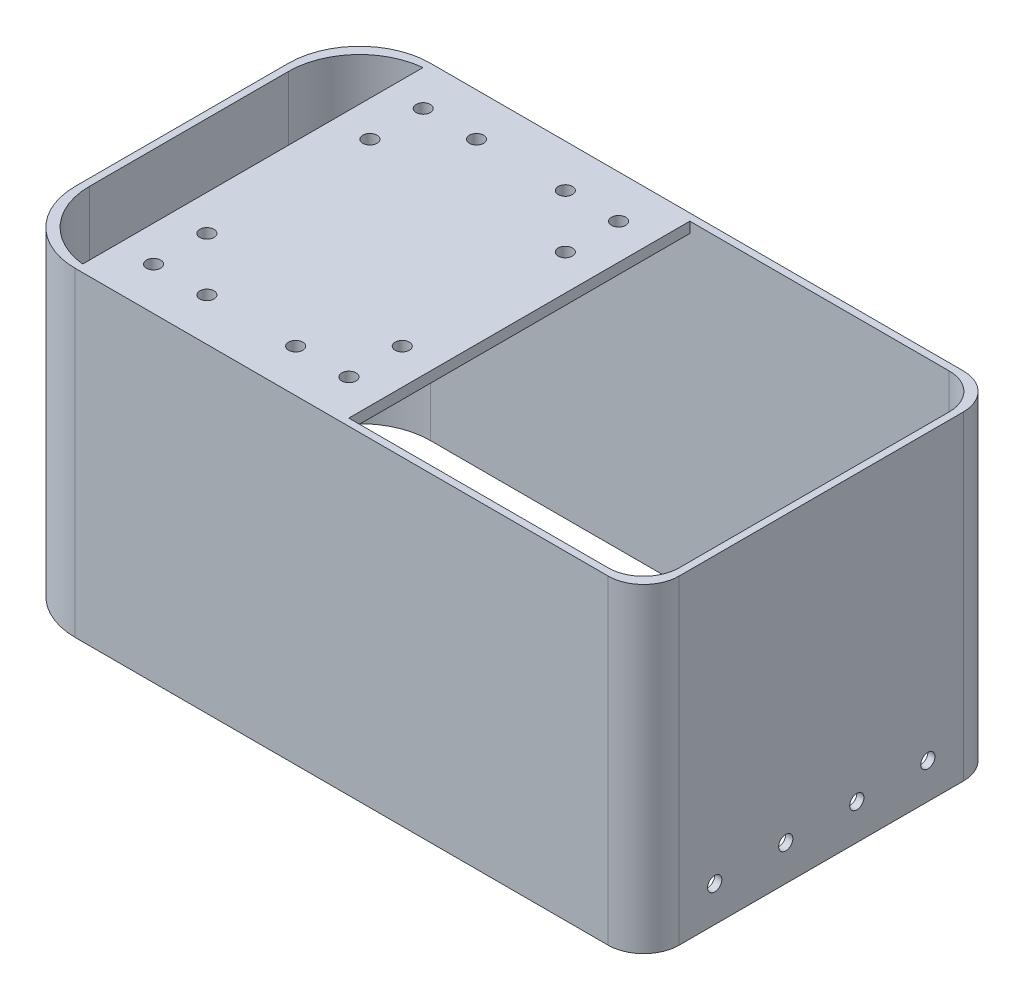
from build123d import *

# Parameters (mm, degrees)
Y_KSEKLIK_EKSTR_ZYON1_DEPTH = 90
IZIM2_W                     = 75
IZIM2_H                     = 100
Y_KSEKLIK_EKSTR_ZYON2_DEPTH = 3
IZIM3_R                     = 2
KES_EKSTR_ZYON1_DEPTH       = 10
IZIM4_R                     = 2
KES_EKSTR_ZYON2_DEPTH       = 10
KES_EKSTR_ZYON3_START       = -10
IZIM5_R                     = 2
KES_EKSTR_ZYON3_DEPTH       = 10


with BuildPart() as part:
    # Çizim1 → Yükseklik-Ekstrüzyon1 (new body)
    with BuildSketch(Plane(origin=(0, 0, 0), x_dir=(1, 0, 0), z_dir=(0, 1, 0))):
        with BuildLine():
            Line((-70, -50), (80, -50))
            ThreePointArc((80, -50), (87.071067812, -47.071067812), (90, -40))
            Line((90, -40), (90, 40))
            ThreePointArc((90, 40), (87.071067812, 47.071067812), (80, 50))
            Line((80, 50), (-70, 50))
            ThreePointArc((-70, 50), (-84.142135624, 44.142135624), (-90, 30))
            Line((-90, 30), (-90, -30))
            ThreePointArc((-90, -30), (-84.142135624, -44.142135624), (-70, -50))
        make_face()
        with BuildLine():
            Line((0, 48), (78, 48))
            ThreePointArc((78, 48), (85.071067812, 45.071067812), (88, 38))
            Line((88, 38), (88, 0))
            Line((88, 0), (88, -38))
            ThreePointArc((88, -38), (85.071067812, -45.071067812), (78, -48))
            Line((78, -48), (-68, -48))
            ThreePointArc((-68, -48), (-82.142135624, -42.142135624), (-88, -28))
            Line((-88, -28), (-88, 28))
            ThreePointArc((-88, 28), (-82.142135624, 42.142135624), (-68, 48))
            Line((-68, 48), (0, 48))
        make_face(mode=Mode.SUBTRACT)
    extrude(amount=Y_KSEKLIK_EKSTR_ZYON1_DEPTH)

    # Çizim2 → Yükseklik-Ekstrüzyon2 (add)
    with BuildSketch(Plane(origin=(0, 90, 0), x_dir=(1, 0, 0), z_dir=(0, 1, 0))):
        with Locations((-32.5, 0)):
            Rectangle(IZIM2_W, IZIM2_H)
    extrude(amount=-Y_KSEKLIK_EKSTR_ZYON2_DEPTH)

    # Çizim3 → Kes-Ekstrüzyon1 (cut)
    with BuildSketch(Plane.ZY.offset(90)):
        with Locations((-20, 10)):
            Circle(IZIM3_R)
        with Locations((-10, 10)):
            Circle(IZIM3_R)
        with Locations((0, 10)):
            Circle(IZIM3_R)
        with Locations((10, 10)):
            Circle(IZIM3_R)
        with Locations((20, 10)):
            Circle(IZIM3_R)
    extrude(amount=-KES_EKSTR_ZYON1_DEPTH, mode=Mode.SUBTRACT)

    # Çizim4 → Kes-Ekstrüzyon2 (cut)
    with BuildSketch(Plane(origin=(0, 90, 0), x_dir=(1, 0, 0), z_dir=(0, 1, 0))):
        with Locations(Location((-60, 37.949874371, 0), (0, 0, 270))):
            Circle(IZIM4_R)
        with Locations(Location((-45, 37.949874371, 0), (0, 0, 270))):
            Circle(IZIM4_R)
        with Locations(Location((-60, 22.949874371, 0), (0, 0, 270))):
            Circle(IZIM4_R)
        with Locations(Location((-5, 22.949874371, 0), (0, 0, 90))):
            Circle(IZIM4_R)
        with Locations(Location((-20, 37.949874371, 0), (0, 0, 90))):
            Circle(IZIM4_R)
        with Locations(Location((-5, 37.949874371, 0), (0, 0, 90))):
            Circle(IZIM4_R)
        with Locations(Location((-5, -37.949874371, 0), (0, 0, 270))):
            Circle(IZIM4_R)
        with Locations(Location((-20, -37.949874371, 0), (0, 0, 270))):
            Circle(IZIM4_R)
        with Locations(Location((-5, -22.949874371, 0), (0, 0, 270))):
            Circle(IZIM4_R)
        with Locations(Location((-60, -22.949874371, 0), (0, 0, 90))):
            Circle(IZIM4_R)
        with Locations(Location((-45, -37.949874371, 0), (0, 0, 90))):
            Circle(IZIM4_R)
        with Locations(Location((-60, -37.949874371, 0), (0, 0, 90))):
            Circle(IZIM4_R)
    extrude(amount=-KES_EKSTR_ZYON2_DEPTH, mode=Mode.SUBTRACT)

    # Çizim5 → Kes-Ekstrüzyon3 (cut)
    with BuildSketch(Plane(origin=(90, 0, 0), x_dir=(0, 0, -1), z_dir=(1, 0, 0)).offset(KES_EKSTR_ZYON3_START)):
        with Locations((-30, 10)):
            Circle(IZIM5_R)
        with Locations(Location((-10, 10, 0), (0, 0, 180))):
            Circle(IZIM5_R)
        with Locations(Location((10, 10, 0), (0, 0, 180))):
            Circle(IZIM5_R)
        with Locations((30, 10)):
            Circle(IZIM5_R)
    extrude(amount=KES_EKSTR_ZYON3_DEPTH, mode=Mode.SUBTRACT)


solid = part.part
